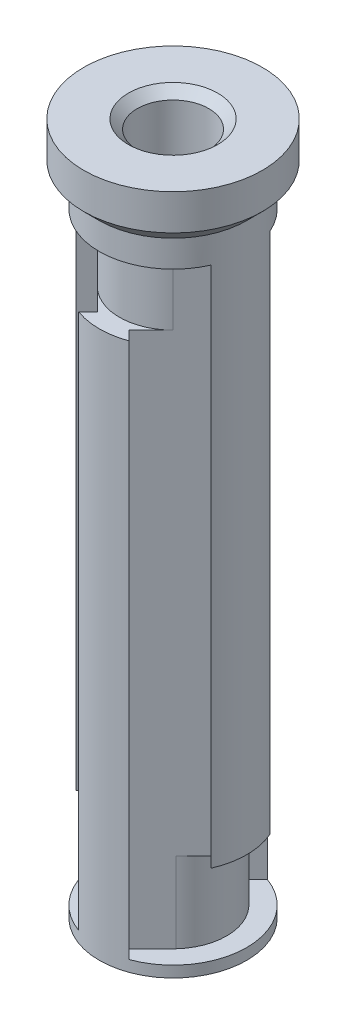
from build123d import *
from OCP.BRepFilletAPI import BRepFilletAPI_MakeChamfer

# Parameters (mm, degrees)
CUT_EXTRUDE1_START = -7.5
CUT_EXTRUDE1_DEPTH = 7.5
CUT_EXTRUDE3_START = -60
CUT_EXTRUDE3_DEPTH = 60
CUT_EXTRUDE4_DEPTH = 9
CHAMFER1_SIZE      = 1
CHAMFER1_SIZE2     = 0.730484553


with BuildPart() as part:
    # Sketch1 → Revolve1 (revolve)
    with BuildSketch(Plane.XY, mode=Mode.PRIVATE) as revolve1_sk:
        Polygon((4, 0), (10, 0), (10, -4), (8.25, -5.75), (8.25, -77.5), (4, -80), align=None)
    revolve(revolve1_sk.sketch.rotate(Axis((0, 0, 0), (0, -1, 0)), 90), axis=Axis((0, 0, 0), (0, -1, 0)))

    # Sketch3 → Cut-Extrude1 (cut)
    with BuildSketch(Plane(origin=(0, -8.75, 0), x_dir=(1, 0, 0), z_dir=(0, 1, 0)).offset(CUT_EXTRUDE1_START)):
        with BuildLine():
            ThreePointArc((4.242640687, 4.242640687), (0, 6), (-4.242640687, 4.242640687))
            Line((-4.242640687, 4.242640687), (-6.363961031, 2.121320344))
            Line((-6.363961031, 2.121320344), (-7.555586623, 3.312945936))
            ThreePointArc((-7.555586623, 3.312945936), (0, 8.25), (7.555586623, 3.312945936))
            Line((7.555586623, 3.312945936), (6.363961031, 2.121320344))
            Line((6.363961031, 2.121320344), (4.242640687, 4.242640687))
        make_face()
        with BuildLine():
            ThreePointArc((7.555586623, -3.312945936), (0, -8.25), (-7.555586623, -3.312945936))
            Line((-7.555586623, -3.312945936), (-6.363961031, -2.121320344))
            Line((-6.363961031, -2.121320344), (-4.242640687, -4.242640687))
            ThreePointArc((-4.242640687, -4.242640687), (0, -6), (4.242640687, -4.242640687))
            Line((4.242640687, -4.242640687), (6.363961031, -2.121320344))
            Line((6.363961031, -2.121320344), (7.555586623, -3.312945936))
        make_face()
    extrude(amount=CUT_EXTRUDE1_DEPTH, mode=Mode.SUBTRACT)

    # Sketch4 → Cut-Extrude3 (cut)
    with BuildSketch(Plane(origin=(0, -16.25, 0), x_dir=(1, 0, 0), z_dir=(0, 1, 0)).offset(CUT_EXTRUDE3_START)):
        with BuildLine():
            Line((2.807762918, 7.757510386), (1.767766953, 6.717514421))
            Line((1.767766953, 6.717514421), (6.363961031, 2.121320344))
            Line((6.363961031, 2.121320344), (7.555586623, 3.312945936))
            ThreePointArc((7.555586623, 3.312945936), (5.638110651, 6.022807342), (2.807762918, 7.757510386))
        make_face()
        with BuildLine():
            Line((-7.555586623, 3.312945936), (-6.363961031, 2.121320344))
            Line((-6.363961031, 2.121320344), (-1.767766953, 6.717514421))
            Line((-1.767766953, 6.717514421), (-2.807762918, 7.757510386))
            ThreePointArc((-2.807762918, 7.757510386), (-5.638110651, 6.022807342), (-7.555586623, 3.312945936))
        make_face()
        with BuildLine():
            Line((-1.767766953, -6.717514421), (-2.807762918, -7.757510386))
            ThreePointArc((-2.807762918, -7.757510386), (-5.638110651, -6.022807342), (-7.555586623, -3.312945936))
            Line((-7.555586623, -3.312945936), (-6.363961031, -2.121320344))
            Line((-6.363961031, -2.121320344), (-1.767766953, -6.717514421))
        make_face()
        with BuildLine():
            Line((7.555586623, -3.312945936), (6.363961031, -2.121320344))
            Line((6.363961031, -2.121320344), (1.767766953, -6.717514421))
            Line((1.767766953, -6.717514421), (2.807762918, -7.757510386))
            ThreePointArc((2.807762918, -7.757510386), (5.638110651, -6.022807342), (7.555586623, -3.312945936))
        make_face()
    extrude(amount=CUT_EXTRUDE3_DEPTH, mode=Mode.SUBTRACT)

    # Sketch6 → Cut-Extrude4 (cut)
    with BuildSketch(Plane(origin=(0, -76.25, 0), x_dir=(1, 0, 0), z_dir=(0, 1, 0))):
        with BuildLine():
            Line((2.807762918, -7.757510386), (1.767766953, -6.717514421))
            Line((1.767766953, -6.717514421), (4.065863992, -4.419417382))
            ThreePointArc((4.065863992, -4.419417382), (6.005206075, 0), (4.065863992, 4.419417382))
            Line((4.065863992, 4.419417382), (1.767766953, 6.717514421))
            Line((1.767766953, 6.717514421), (2.807762918, 7.757510386))
            ThreePointArc((2.807762918, 7.757510386), (8.25, 0), (2.807762918, -7.757510386))
        make_face()
        with BuildLine():
            Line((-1.767766953, 6.717514421), (-2.807762918, 7.757510386))
            ThreePointArc((-2.807762918, 7.757510386), (-8.25, 0), (-2.807762918, -7.757510386))
            Line((-2.807762918, -7.757510386), (-1.767766953, -6.717514421))
            Line((-1.767766953, -6.717514421), (-4.065863992, -4.419417382))
            ThreePointArc((-4.065863992, -4.419417382), (-6.005206075, 0), (-4.065863992, 4.419417382))
            Line((-4.065863992, 4.419417382), (-1.767766953, 6.717514421))
        make_face()
    extrude(amount=CUT_EXTRUDE4_DEPTH, mode=Mode.SUBTRACT)

    # Chamfer1: one chamfer whose edges measure the first distance from different faces: ONE call of the kernel's chamfer builder (chamfer() names one face for all edges)
    chamfer1_edges_1 = [part.edges().sort_by_distance(p)[0] for p in [
        (0, 0, -4),
    ]]
    chamfer1_edges_2 = [part.edges().sort_by_distance(p)[0] for p in [
        (0, -80, -4),
    ]]
    chamfer1_side_2 = [part.faces().sort_by_distance(p)[0] for p in [
        (0, -40, -4),
    ]]
    chamfer1 = BRepFilletAPI_MakeChamfer(part.part.solid().wrapped)
    for e in chamfer1_edges_1:
        chamfer1.Add(CHAMFER1_SIZE, e.wrapped)
    for e in chamfer1_edges_2:
        chamfer1.Add(CHAMFER1_SIZE, CHAMFER1_SIZE2, e.wrapped, chamfer1_side_2[0].wrapped)  # the first distance lies on this face
    add(Compound.cast(chamfer1.Shape()), mode=Mode.REPLACE)


solid = part.part
